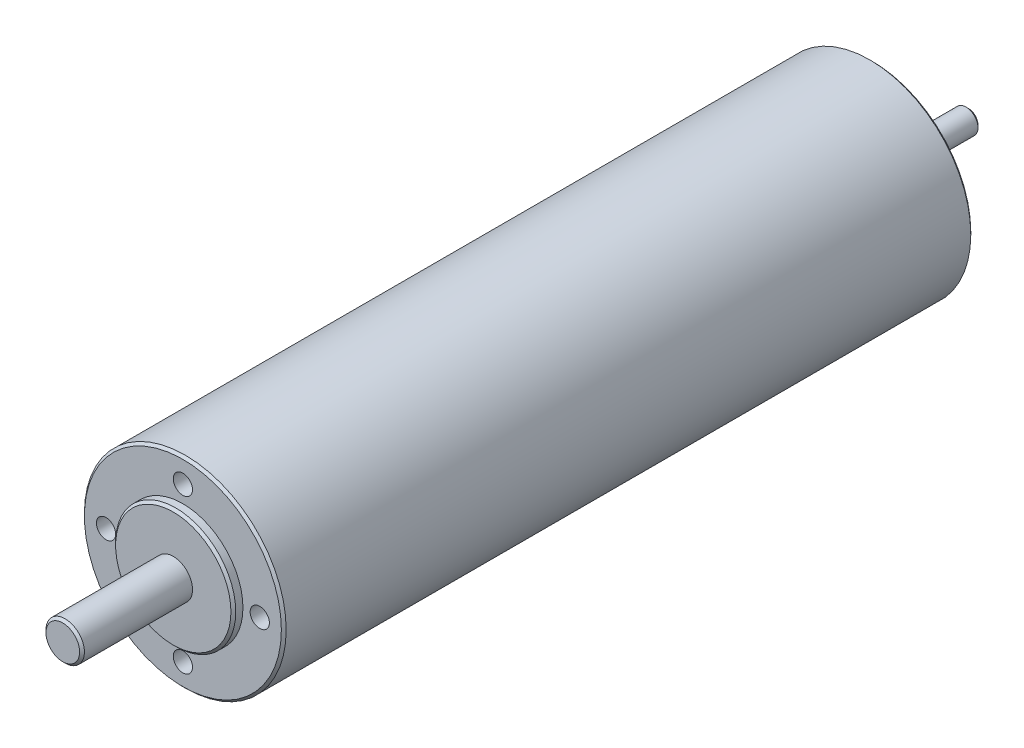
from build123d import *

# Parameters (mm, degrees)
ESQUISSE1_R          = 21
BASE_EXTRUSION_DEPTH = 143.5
ESQUISSE2_R          = 12.5
BOSS_EXTRU_1_DEPTH   = 2
ESQUISSE3_R          = 4
BOSS_EXTRU_2_DEPTH   = 23
ESQUISSE4_R          = 11
BOSS_EXTRU_3_DEPTH   = 2
ESQUISSE5_R          = 2.5
BOSS_EXTRU_4_DEPTH   = 18
CHANFREIN1_SIZE      = 0.5
SKETCH1_R            = 2
EXTRUDE1_DEPTH       = 10


with BuildPart() as part:
    # Esquisse1 → Base-Extrusion (new body)
    with BuildSketch(Plane.XY):
        Circle(ESQUISSE1_R)
    extrude(amount=-BASE_EXTRUSION_DEPTH)

    # Esquisse2 → Boss.-Extru.1 (add)
    with BuildSketch(Plane.XY):
        Circle(ESQUISSE2_R)
    extrude(amount=BOSS_EXTRU_1_DEPTH)

    # Esquisse3 → Boss.-Extru.2 (add)
    with BuildSketch(Plane.XY.offset(2)):
        Circle(ESQUISSE3_R)
    extrude(amount=BOSS_EXTRU_2_DEPTH)

    # Esquisse4 → Boss.-Extru.3 (add)
    with BuildSketch(Plane(origin=(0, 0, -143.5), x_dir=(-1, 0, 0), z_dir=(0, 0, -1))):
        with Locations(Location((0, 0, 0), (0, 0, 180))):
            Circle(ESQUISSE4_R)
    extrude(amount=BOSS_EXTRU_3_DEPTH)

    # Esquisse5 → Boss.-Extru.4 (add)
    with BuildSketch(Plane(origin=(0, 0, -145.5), x_dir=(-1, 0, 0), z_dir=(0, 0, -1))):
        Circle(ESQUISSE5_R)
    extrude(amount=BOSS_EXTRU_4_DEPTH)

    # Chanfrein1
    chanfrein1_edges = [part.edges().sort_by_distance(p)[0] for p in [
        (-11, 0, -145.5),
        (2.5, 0, -163.5),
        (-21, 0, 0),
        (-21, 0, -143.5),
        (-12.5, 0, 2),
        (-4, 0, 25),
    ]]
    chamfer(chanfrein1_edges, length=CHANFREIN1_SIZE)

    # Sketch1 → Extrude1 (cut)
    with BuildSketch(Plane.XY):
        with Locations((0, 16)):
            Circle(SKETCH1_R)
        with Locations((16, 0)):
            Circle(SKETCH1_R)
        with Locations((0, -16)):
            Circle(SKETCH1_R)
        with Locations((-16, 0)):
            Circle(SKETCH1_R)
    extrude(amount=-EXTRUDE1_DEPTH, mode=Mode.SUBTRACT)


solid = part.part
